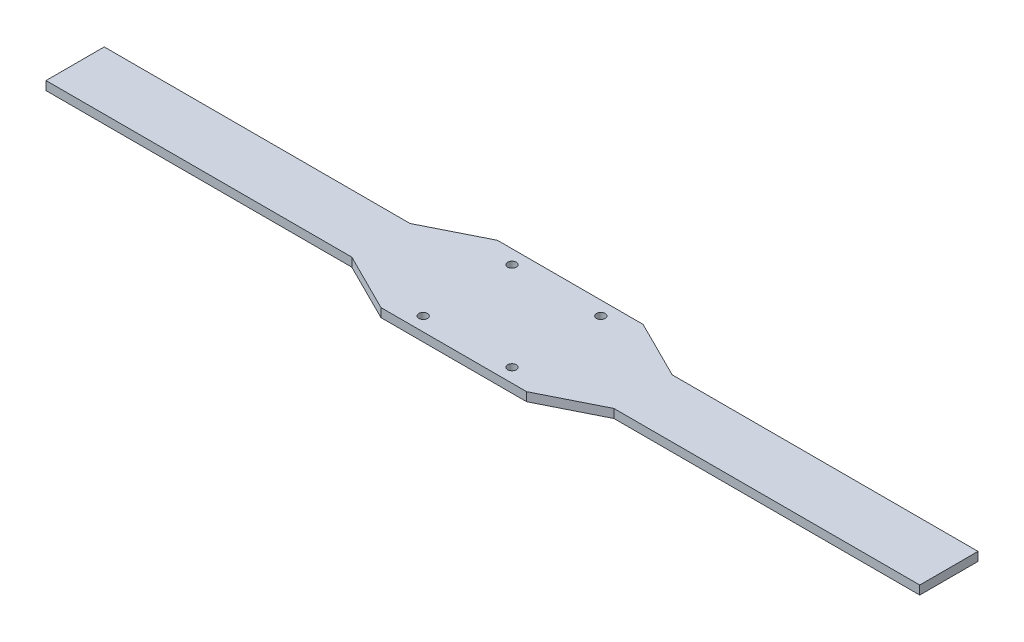
from build123d import *

# Parameters (mm, degrees)
SKETCH1_W           = 300
SKETCH1_H           = 40
SKETCH1_R           = 1.5
BOSS_EXTRUDE1_DEPTH = 1.5
CUT_EXTRUDE1_DEPTH  = 152.35719342


with BuildPart() as part:
    # Sketch1 → Boss-Extrude1 (new, symmetric)
    with BuildSketch(Plane(origin=(0, 0, 0), x_dir=(1, 0, 0), z_dir=(0, 1, 0))):
        Rectangle(SKETCH1_W, SKETCH1_H)
        with Locations(Location((-15.25, 15.25, 0), (0, 0, 270))):
            Circle(SKETCH1_R, mode=Mode.SUBTRACT)
        with Locations(Location((15.25, 15.25, 0), (0, 0, 270))):
            Circle(SKETCH1_R, mode=Mode.SUBTRACT)
        with Locations(Location((15.25, -15.25, 0), (0, 0, 270))):
            Circle(SKETCH1_R, mode=Mode.SUBTRACT)
        with Locations(Location((-15.25, -15.25, 0), (0, 0, 270))):
            Circle(SKETCH1_R, mode=Mode.SUBTRACT)
    extrude(amount=BOSS_EXTRUDE1_DEPTH, both=True)

    # Sketch2 → Cut-Extrude1 (cut, through all)
    with BuildSketch(Plane.XZ.offset(1.5)):
        Polygon((-150, 20), (-150, 10), (-45, 10), (-25, 20), align=None)
        Polygon((150, 20), (25, 20), (45, 10), (150, 10), align=None)
        Polygon((150, -20), (150, -10), (45, -10), (25, -20), align=None)
        Polygon((-150, -20), (-25, -20), (-45, -10), (-150, -10), align=None)
    extrude(amount=-CUT_EXTRUDE1_DEPTH, mode=Mode.SUBTRACT)


solid = part.part
